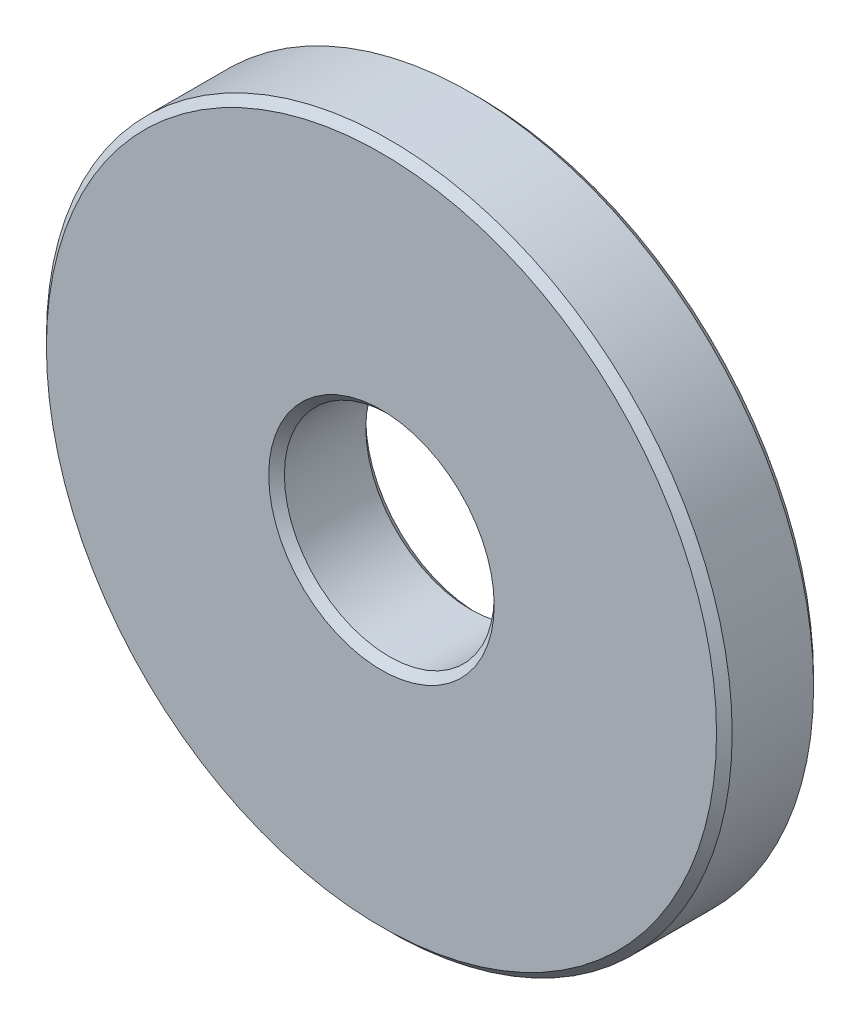
from build123d import *

# Parameters (mm, degrees)
SKETCH1_R           = 10.95
SKETCH1_R_2         = 3.35
BOSS_EXTRUDE1_DEPTH = 3.1
CHAMFER1_SIZE       = 0.25


with BuildPart() as part:
    # Sketch1 → Boss-Extrude1 (new body)
    with BuildSketch(Plane.XY):
        with Locations(Location((0, 0, 0), (0, 0, 180))):
            Circle(SKETCH1_R)
        with Locations(Location((0, 0, 0), (0, 0, 180))):
            Circle(SKETCH1_R_2, mode=Mode.SUBTRACT)
    extrude(amount=BOSS_EXTRUDE1_DEPTH)

    # Chamfer1
    chamfer1_edges = [part.edges().sort_by_distance(p)[0] for p in [
        (10.95, 0, 0),
        (10.95, 0, 3.1),
        (3.35, 0, 0),
        (3.35, 0, 3.1),
    ]]
    chamfer(chamfer1_edges, length=CHAMFER1_SIZE)


solid = part.part
